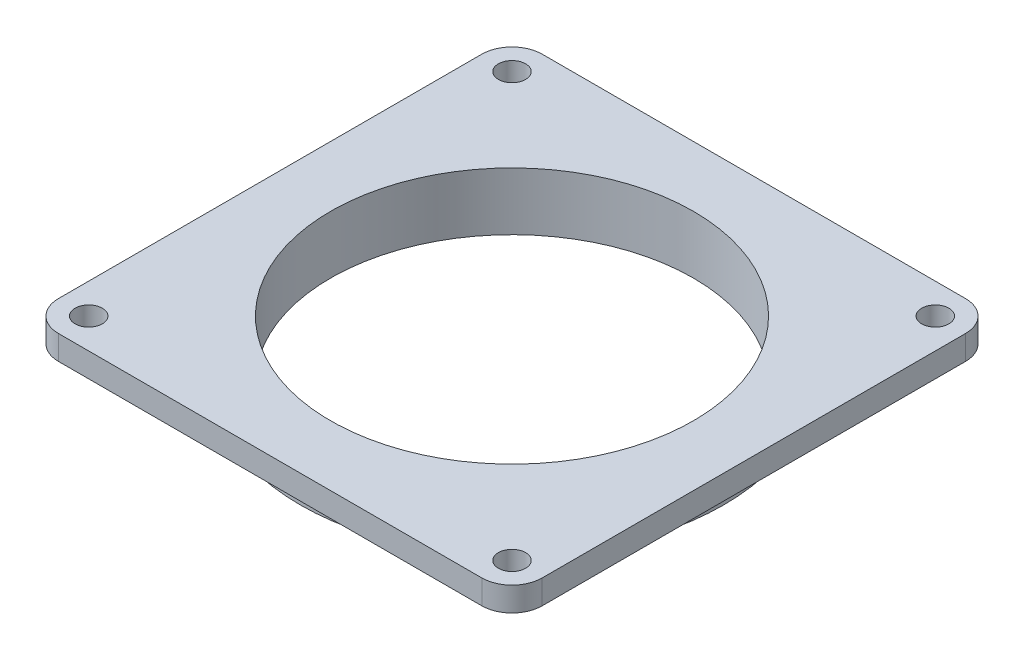
from build123d import *

# Parameters (mm, degrees)
SKETCH1_R           = 35
SKETCH1_R_2         = 30
BOSS_EXTRUDE1_DEPTH = 5.5626
SKETCH2_W           = 80
SKETCH2_H           = 80
SKETCH2_R           = 2.25
SKETCH2_R_2         = 30
BOSS_EXTRUDE3_DEPTH = 4
FILLET1_R           = 5


with BuildPart() as part:
    # Sketch1 → Boss-Extrude1 (new body)
    with BuildSketch(Plane(origin=(0, 0, 0), x_dir=(1, 0, 0), z_dir=(0, 1, 0))):
        with Locations(Location((0, 0, 0), (0, 0, 90))):
            Circle(SKETCH1_R)
        with Locations(Location((0, 0, 0), (0, 0, 90))):
            Circle(SKETCH1_R_2, mode=Mode.SUBTRACT)
    extrude(amount=BOSS_EXTRUDE1_DEPTH)

    # Sketch2 → Boss-Extrude3 (add)
    with BuildSketch(Plane(origin=(0, 5.5626, 0), x_dir=(1, 0, 0), z_dir=(0, 1, 0))):
        Rectangle(SKETCH2_W, SKETCH2_H)
        with Locations(Location((-35, -35, 0), (0, 0, 270))):
            Circle(SKETCH2_R, mode=Mode.SUBTRACT)
        with Locations(Location((-35, 35, 0), (0, 0, 270))):
            Circle(SKETCH2_R, mode=Mode.SUBTRACT)
        with Locations(Location((35, 35, 0), (0, 0, 270))):
            Circle(SKETCH2_R, mode=Mode.SUBTRACT)
        with Locations(Location((35, -35, 0), (0, 0, 270))):
            Circle(SKETCH2_R, mode=Mode.SUBTRACT)
        with Locations(Location((0, 0, 0), (0, 0, 90))):
            Circle(SKETCH2_R_2, mode=Mode.SUBTRACT)
    extrude(amount=BOSS_EXTRUDE3_DEPTH)

    # Fillet1
    fillet1_edges = [part.edges().sort_by_distance(p)[0] for p in [
        (-40, 7.5626, -40),
        (-40, 7.5626, 40),
        (40, 7.5626, 40),
        (40, 7.5626, -40),
    ]]
    fillet(fillet1_edges, radius=FILLET1_R)


solid = part.part
